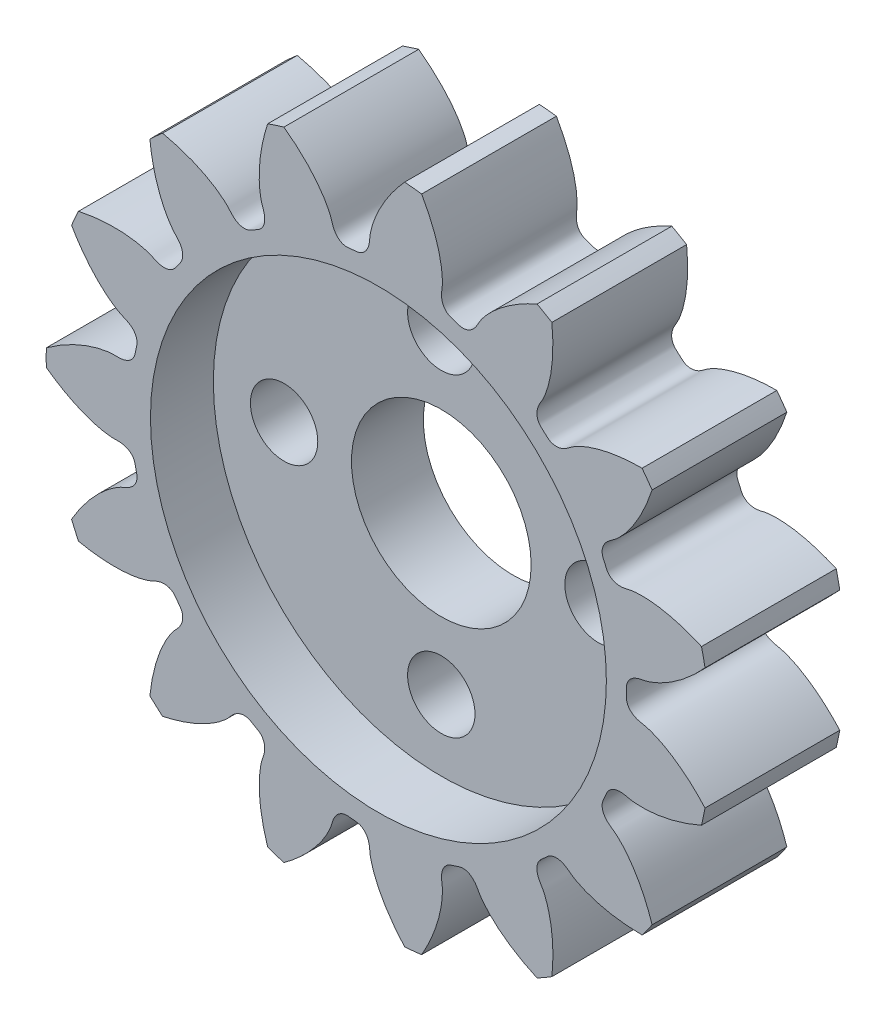
from build123d import *

# Parameters (mm, degrees)
SKETCHREVOLVESPURASSEMBLY01PINION_W       = 6
SKETCHREVOLVESPURASSEMBLY01PINION_H       = 14.791666667
TOOTHEXTRUDECUTSPURASSEMBLY01PINION_DEPTH = 9.525
PATTERNSPURASSEMBLY01PINION_COUNT         = 15
SKETCH_5_R                                = 10.15
CUT_EXTRUDE_2_DEPTH                       = 2.8
SKETCH_6_R                                = 1.5
CUT_EXTRUDE_3_DEPTH                       = 5
SKETCH_7_R                                = 4
CUT_EXTRUDE_4_DEPTH                       = 22.129699688


with BuildPart() as part:
    # SketchRevolveSpurAssembly01Pinion → SpurAssembly01Pinion (revolve)
    with BuildSketch(Plane(origin=(0, 0, 0), x_dir=(0, 0, -1), z_dir=(1, 0, 0))):
        with Locations((-6.525, 7.395833334)):
            Rectangle(SKETCHREVOLVESPURASSEMBLY01PINION_W, SKETCHREVOLVESPURASSEMBLY01PINION_H)
    revolve(axis=Axis((0, 0, 0), (0, 0, -1)))

    # SketchToothSpurAssembly01Pinion → ToothExtrudeCutSpurAssembly01Pinion (cut, symmetric)
    with BuildSketch(Plane.XY):
        with BuildLine():
            ThreePointArc((14.638884286, 2.810579285), (14.90625, 0), (14.638884286, -2.810579285))
            add(Edge.make_bspline(
                [(14.638884286, -2.810579285), (14.489526239, -2.639570038), (14.262121105, -2.39781971), (13.948985357, -2.102680017), (13.725950595, -1.908327904), (13.509469113, -1.734068277), (13.300748694, -1.579075941), (13.100942009, -1.44246241), (12.91114357, -1.323279437), (12.732386773, -1.220522579), (12.565641483, -1.133132948), (12.411810518, -1.060005964), (12.271730398, -0.999977982), (12.146159325, -0.951883472), (12.035805516, -0.914393811), (11.941234298, -0.886516604), (11.818760346, -0.854605047), (11.71455508, -0.840495278), (11.627781544, -0.819887719), (11.595297122, -0.811311207), (11.563143388, -0.801860949), (11.531256087, -0.791475005), (11.499566792, -0.780057526), (11.468000598, -0.767493063), (11.436478135, -0.753635997), (11.404917888, -0.738305198), (11.373240768, -0.721275725), (11.341377636, -0.702269909), (11.309281368, -0.680947798), (11.276945367, -0.656898479), (11.24443084, -0.629634966), (11.211905032, -0.598597549), (11.179691029, -0.563173419), (11.148326241, -0.522743599), (11.118616797, -0.476769147), (11.091670798, -0.424924982), (11.068849378, -0.367268493), (11.051704278, -0.304419723), (11.041890981, -0.240368056), (11.038648547, -0.138386807), (11.043913623, 0), (11.038648547, 0.138386807), (11.041890981, 0.240368056), (11.051704278, 0.304419723), (11.068849378, 0.367268493), (11.091670798, 0.424924982), (11.118616797, 0.476769147), (11.148326241, 0.522743599), (11.179691029, 0.563173419), (11.211905032, 0.598597549), (11.24443084, 0.629634966), (11.276945367, 0.656898479), (11.309281368, 0.680947798), (11.341377636, 0.702269909), (11.373240768, 0.721275725), (11.404917888, 0.738305198), (11.436478135, 0.753635997), (11.468000598, 0.767493063), (11.499566792, 0.780057526), (11.531256087, 0.791475005), (11.563143388, 0.801860949), (11.595297122, 0.811311207), (11.627781544, 0.819887719), (11.71455508, 0.840495278), (11.818760346, 0.854605047), (11.941234298, 0.886516604), (12.035805516, 0.914393811), (12.146159325, 0.951883472), (12.271730398, 0.999977982), (12.411810518, 1.060005964), (12.565641483, 1.133132948), (12.732386773, 1.220522579), (12.91114357, 1.323279437), (13.100942009, 1.44246241), (13.300748694, 1.579075941), (13.509469113, 1.734068277), (13.725950595, 1.908327904), (13.948985357, 2.102680017), (14.262121105, 2.39781971), (14.489526239, 2.639570038), (14.638884286, 2.810579285)],
                knots=[0, 0, 0, 0, 0.071008254, 0.103709424, 0.134541956, 0.163505849, 0.190601105, 0.215827722, 0.2391857, 0.260675041, 0.280295744, 0.298047808, 0.313931234, 0.327946022, 0.340092173, 0.350369685, 0.358778559, 0.379649637, 0.383167637, 0.38666661, 0.390156188, 0.393647492, 0.397153388, 0.400688784, 0.404270983, 0.407920054, 0.411659242, 0.415515362, 0.419519117, 0.423705232, 0.428112214, 0.432781448, 0.437755221, 0.443073169, 0.448766702, 0.454851287, 0.461317358, 0.468122028, 0.475185097, 0.481525584, 0.5, 0.518474416, 0.524814903, 0.531877972, 0.538682642, 0.545148713, 0.551233298, 0.556926831, 0.562244779, 0.567218552, 0.571887786, 0.576294768, 0.580480883, 0.584484638, 0.588340758, 0.592079946, 0.595729017, 0.599311216, 0.602846612, 0.606352508, 0.609843812, 0.61333339, 0.616832363, 0.620350363, 0.641221441, 0.649630315, 0.659907827, 0.672053978, 0.686068766, 0.701952192, 0.719704256, 0.739324959, 0.7608143, 0.784172278, 0.809398895, 0.836494151, 0.865458044, 0.896290576, 0.928991746, 1, 1, 1, 1], degree=3))
        make_face()
    toothextrudecutspurassembly01pinion = extrude(amount=TOOTHEXTRUDECUTSPURASSEMBLY01PINION_DEPTH, both=True, mode=Mode.SUBTRACT)

    # PatternSpurAssembly01Pinion: ToothExtrudeCutSpurAssembly01Pinion ×15 about axis
    patternspurassembly01pinion_axis = Axis((0, 0, 50), (0, 0, -1))
    for i in range(1, PATTERNSPURASSEMBLY01PINION_COUNT):
        add(toothextrudecutspurassembly01pinion.rotate(patternspurassembly01pinion_axis, i * 360 / PATTERNSPURASSEMBLY01PINION_COUNT), mode=Mode.SUBTRACT)

    # Эскиз5 → Вырез-Вытянуть2 (cut)
    with BuildSketch(Plane.XY.offset(9.525)):
        Circle(SKETCH_5_R)
    extrude(amount=-CUT_EXTRUDE_2_DEPTH, mode=Mode.SUBTRACT)

    # Эскиз6 → Вырез-Вытянуть3 (cut)
    with BuildSketch(Plane.XY.offset(6.725)):
        with Locations((0, 7)):
            Circle(SKETCH_6_R)
        with Locations((7, 0)):
            Circle(SKETCH_6_R)
        with Locations((0, -7)):
            Circle(SKETCH_6_R)
        with Locations((-7, 0)):
            Circle(SKETCH_6_R)
    extrude(amount=-CUT_EXTRUDE_3_DEPTH, mode=Mode.SUBTRACT)

    # Эскиз7 → Вырез-Вытянуть4 (cut, through all)
    with BuildSketch(Plane.XY.offset(6.725)):
        Circle(SKETCH_7_R)
    extrude(amount=-CUT_EXTRUDE_4_DEPTH, mode=Mode.SUBTRACT)


solid = part.part
